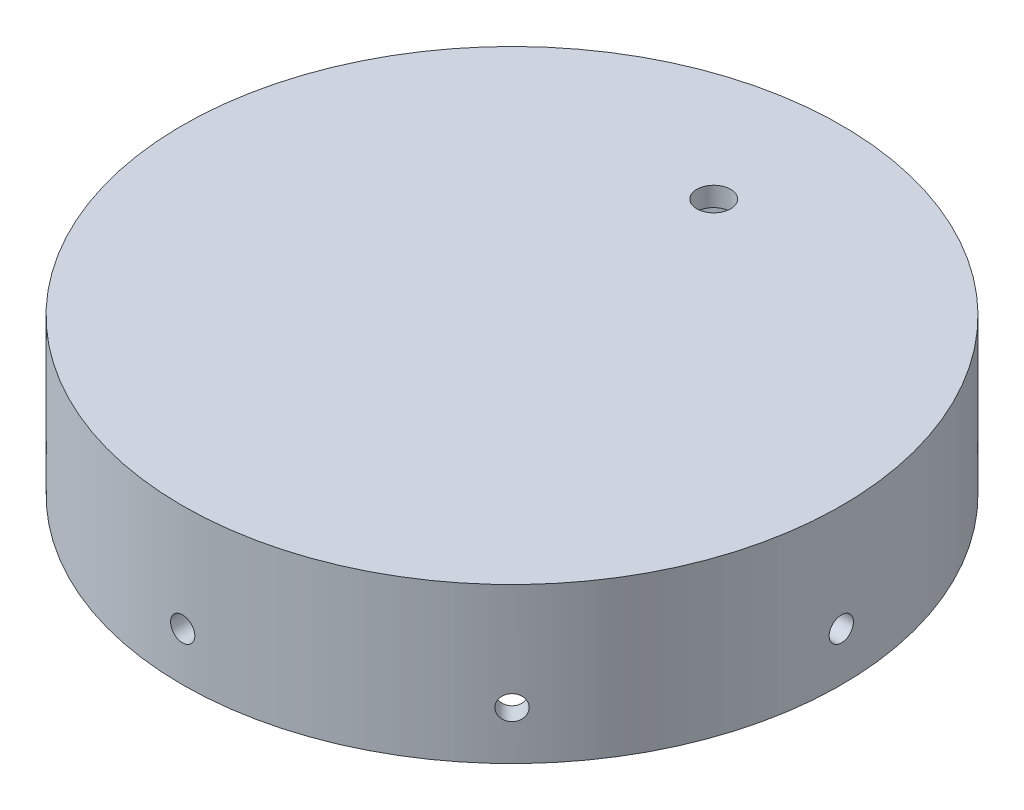
from build123d import *

# Parameters (mm, degrees)
SKETCH_1_R               = 34
EXTRUDE_1_DEPTH          = 16
CUT_EXTRUDE_1_REACH      = 52.675
CUT_EXTRUDE_1_END_RADIUS = 34
SKETCH_2_R               = 1.25
PATTERN_CIRCULAR_1_COUNT = 8
SKETCH_3_R               = 32
CUT_EXTRUDE_2_DEPTH      = 14
SKETCH_5_R               = 1.748779673
CUT_EXTRUDE_3_DEPTH      = 51.675438003


with BuildPart() as part:
    # 草图1 → 凸台-拉伸1 (new body)
    with BuildSketch(Plane(origin=(0, 0, 0), x_dir=(1, 0, 0), z_dir=(0, 1, 0))):
        with Locations(Location((0, 0, 0), (0, 0, 270))):
            Circle(SKETCH_1_R)
    extrude(amount=EXTRUDE_1_DEPTH)

    # 切除-拉伸1: up to this cylinder (the profile starts inside it)
    cut_extrude_1_end = Plane(origin=(0, 5, 0), z_dir=(0, -1, 0)) * Cylinder(CUT_EXTRUDE_1_END_RADIUS, 174.35, mode=Mode.PRIVATE)
    # 草图2 → 切除-拉伸1 (cut, up to the surface)
    with BuildSketch(Plane.XY, mode=Mode.PRIVATE) as cut_extrude_1_sk1:
        with Locations((0, 5)):
            Circle(SKETCH_2_R)
    cut_extrude_1_tool1 = extrude(cut_extrude_1_sk1.sketch, amount=-CUT_EXTRUDE_1_REACH, mode=Mode.PRIVATE) & cut_extrude_1_end
    cut_extrude_1 = cut_extrude_1_tool1.solids().sort_by_distance((0, 5, 0))[0]
    add(cut_extrude_1, mode=Mode.SUBTRACT)

    # 阵列(圆周)1: 切除-拉伸1 ×8 about axis
    pattern_circular_1_axis = Axis((0, 16, 0), (0, 1, 0))
    for i in range(1, PATTERN_CIRCULAR_1_COUNT):
        add(cut_extrude_1.rotate(pattern_circular_1_axis, i * 360 / PATTERN_CIRCULAR_1_COUNT), mode=Mode.SUBTRACT)

    # 草图3 → 切除-拉伸2 (cut)
    with BuildSketch(Plane(origin=(0, 0, 0), x_dir=(1, 0, 0), z_dir=(0, 1, 0))):
        with Locations(Location((0, 0, 0), (0, 0, 270))):
            Circle(SKETCH_3_R)
    extrude(amount=CUT_EXTRUDE_2_DEPTH, mode=Mode.SUBTRACT)

    # 草图5 → 切除-拉伸3 (cut, through all)
    with BuildSketch(Plane(origin=(0, 0, 0), x_dir=(1, 0, 0), z_dir=(0, 1, 0))):
        with Locations(Location((0, 20.814842856, 0), (0, 0, 270))):
            Circle(SKETCH_5_R)
    extrude(amount=CUT_EXTRUDE_3_DEPTH, mode=Mode.SUBTRACT)


solid = part.part
